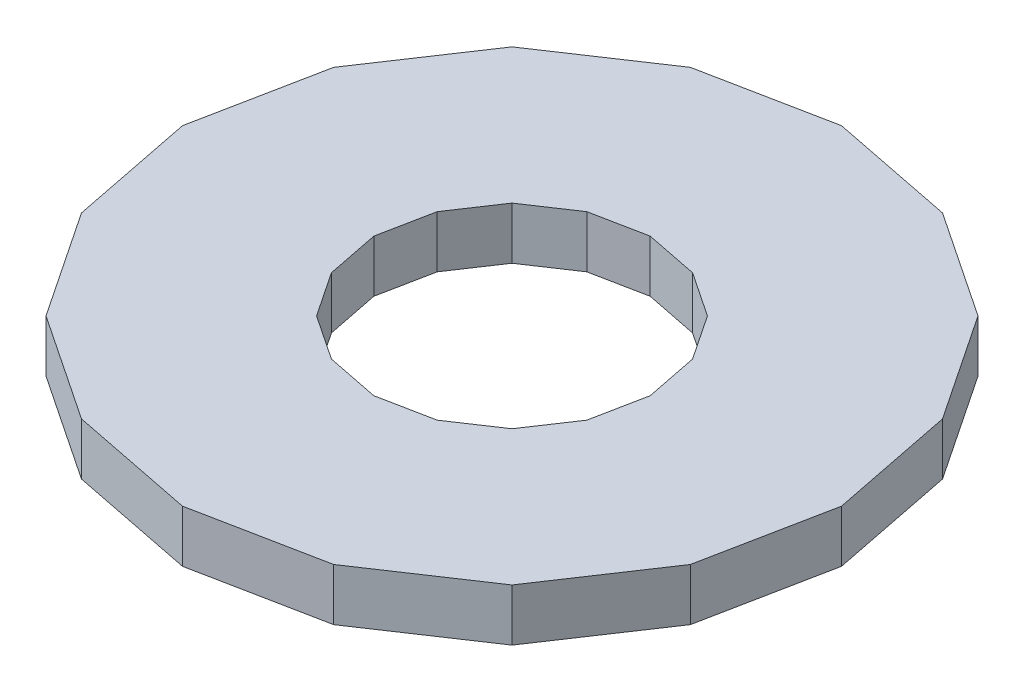
from build123d import *

# Parameters (mm, degrees)
BOSS_EXTRUDE1_DEPTH = 19.05


with BuildPart() as part:
    # Sketch1 → Boss-Extrude1 (new body)
    with BuildSketch(Plane(origin=(0, 0, 0), x_dir=(1, 0, 0), z_dir=(0, 1, 0))):
        Polygon((120.431396889, 0), (111.264102658, 46.087100326), (85.157857408, 85.157857408), (46.087100326, 111.264102658), (0, 120.431396889), (-46.087100326, 111.264102658), (-85.157857408, 85.157857408), (-111.264102658, 46.087100326), (-120.431396889, 0), (-111.264102658, -46.087100326), (-85.157857408, -85.157857408), (-46.087100326, -111.264102658), (0, -120.431396889), (46.087100326, -111.264102658), (85.157857408, -85.157857408), (111.264102658, -46.087100326), align=None)
        Polygon((50.507835259, 0), (46.663155228, 19.328511758), (35.714432815, 35.714432815), (19.328511758, 46.663155228), (0, 50.507835259), (-19.328511758, 46.663155228), (-35.714432815, 35.714432815), (-46.663155228, 19.328511758), (-50.507835259, 0), (-46.663155228, -19.328511758), (-35.714432815, -35.714432815), (-19.328511758, -46.663155228), (0, -50.507835259), (19.328511758, -46.663155228), (35.714432815, -35.714432815), (46.663155228, -19.328511758), align=None, mode=Mode.SUBTRACT)
    extrude(amount=BOSS_EXTRUDE1_DEPTH)


solid = part.part
